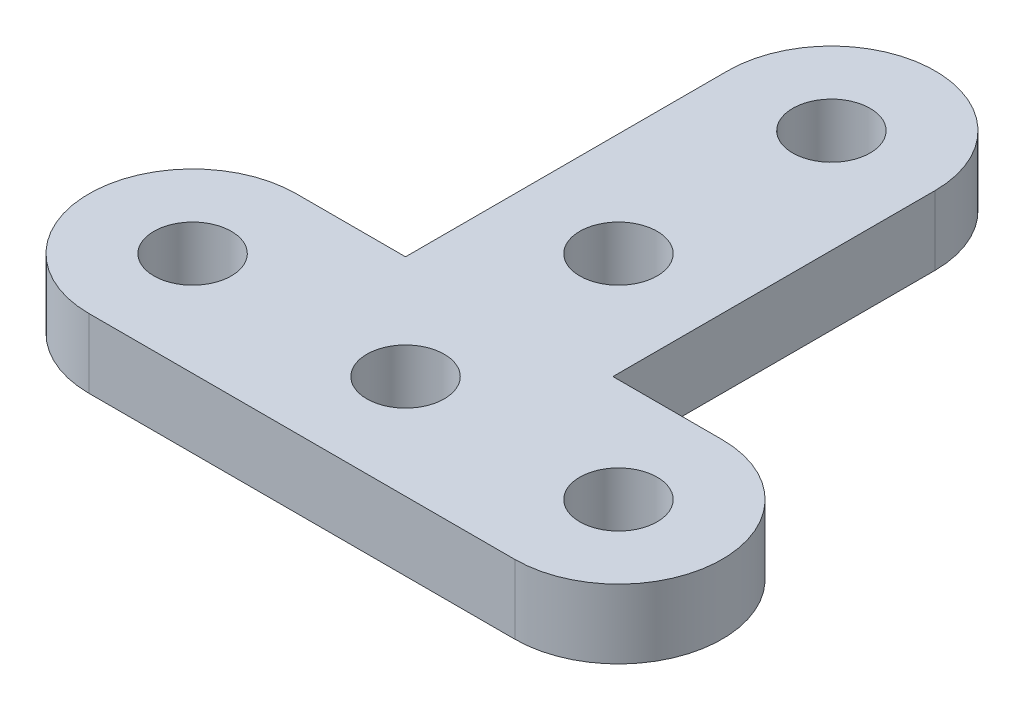
from build123d import *

# Parameters (mm, degrees)
SKETCH1_R           = 1.778
BOSS_EXTRUDE1_DEPTH = 3.175


with BuildPart() as part:
    # Sketch1 → Boss-Extrude1 (new body)
    with BuildSketch(Plane(origin=(0, 3.175, 0), x_dir=(1, 0, 0), z_dir=(0, 1, 0))):
        with BuildLine():
            Line((4.7625, 4.7625), (4.7625, 19.558))
            ThreePointArc((4.7625, 19.558), (0, 24.3205), (-4.7625, 19.558))
            Line((-4.7625, 19.558), (-4.7625, 4.7625))
            Line((-4.7625, 4.7625), (-9.779, 4.7625))
            ThreePointArc((-9.779, 4.7625), (-14.5415, 0), (-9.779, -4.7625))
            Line((-9.779, -4.7625), (9.779, -4.7625))
            ThreePointArc((9.779, -4.7625), (14.5415, 0), (9.779, 4.7625))
            Line((9.779, 4.7625), (4.7625, 4.7625))
        make_face()
        with Locations(Location((0, 19.558, 0), (0, 0, 270))):
            Circle(SKETCH1_R, mode=Mode.SUBTRACT)
        with Locations(Location((9.779, 0, 0), (0, 0, 270))):
            Circle(SKETCH1_R, mode=Mode.SUBTRACT)
        with Locations(Location((0, 9.779, 0), (0, 0, 270))):
            Circle(SKETCH1_R, mode=Mode.SUBTRACT)
        with Locations(Location((-9.779, 0, 0), (0, 0, 270))):
            Circle(SKETCH1_R, mode=Mode.SUBTRACT)
        with Locations(Location((0, 0, 0), (0, 0, 270))):
            Circle(SKETCH1_R, mode=Mode.SUBTRACT)
    extrude(amount=-BOSS_EXTRUDE1_DEPTH)


solid = part.part
